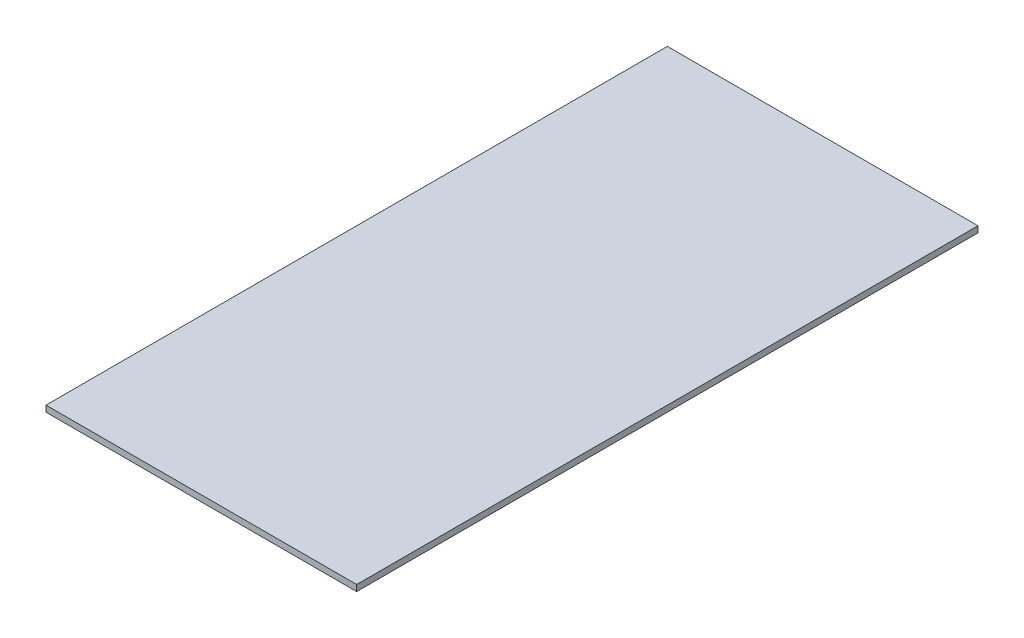
from build123d import *

# Parameters (mm, degrees)
SKETCH2_W           = 304.8
SKETCH2_H           = 609.6
BOSS_EXTRUDE1_DEPTH = 3.0226


with BuildPart() as part:
    # Sketch2 → Boss-Extrude1 (new, symmetric)
    with BuildSketch(Plane(origin=(0, 0, 0), x_dir=(1, 0, 0), z_dir=(0, 1, 0))):
        Rectangle(SKETCH2_W, SKETCH2_H)
    extrude(amount=BOSS_EXTRUDE1_DEPTH, both=True)


solid = part.part
